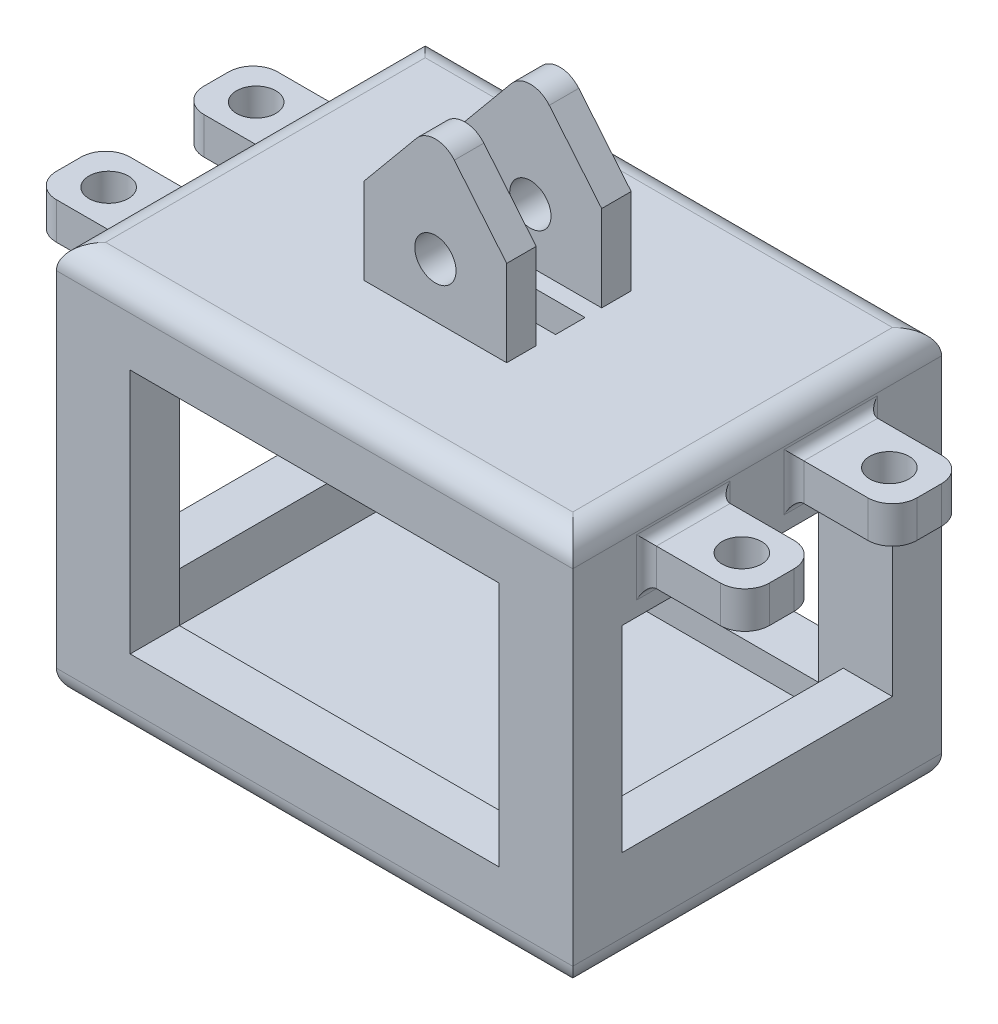
from build123d import *

# Parameters (mm, degrees)
SKETCH1_W               = 105
SKETCH1_H               = 75
BOSS_EXTRUDE1_DEPTH     = 80
SHELL1_T                = -10
SKETCH2_W               = 10
SKETCH2_H               = 60
BOSS_EXTRUDE2_DEPTH     = 60
FILLET1_R               = 5
SKETCH3_W               = 75
SKETCH3_H               = 50
CUT_EXTRUDE1_DEPTH      = 152.822264507
SKETCH4_W               = 55
SKETCH4_H               = 40
CUT_EXTRUDE2_DEPTH      = 152.822264507
SKETCH5_W               = 15
SKETCH5_H               = 7.5
BOSS_EXTRUDE3_DEPTH     = 20
SKETCH6_R               = 4
CUT_EXTRUDE3_DEPTH      = 163.807401552
MIRROR2_COPY_1_SKETCH_W = 15
MIRROR2_COPY_1_SKETCH_H = 7.5
MIRROR2_COPY_1_DEPTH    = 20
MIRROR2_COPY_2_SKETCH_R = 4
MIRROR2_COPY_2_DEPTH    = 163.807401552
FILLET3_R               = 2
SKETCH7_W               = 29
SKETCH7_H               = 6
CUT_EXTRUDE4_DEPTH      = 15
SKETCH8_W               = 29
SKETCH8_H               = 6
BOSS_EXTRUDE4_DEPTH     = 35
SKETCH9_R               = 4.2
CUT_EXTRUDE5_DEPTH      = 35


with BuildPart() as part:
    # Sketch1 → Boss-Extrude1 (new body)
    with BuildSketch(Plane(origin=(0, 0, 0), x_dir=(1, 0, 0), z_dir=(0, 1, 0))):
        with Locations((52.5, 37.5)):
            Rectangle(SKETCH1_W, SKETCH1_H)
    extrude(amount=BOSS_EXTRUDE1_DEPTH)

    # Shell1
    shell1_openings = [part.faces().sort_by_distance(p)[0] for p in [
        (0, 40, -37.5),
    ]]
    offset(amount=SHELL1_T, openings=shell1_openings, kind=Kind.INTERSECTION)

    # Sketch2 → Boss-Extrude2 (add)
    with BuildSketch(Plane.XY.offset(-65)):
        with Locations((5, 40)):
            Rectangle(SKETCH2_W, SKETCH2_H)
    extrude(amount=BOSS_EXTRUDE2_DEPTH)

    # Fillet1
    fillet1_edges = [part.edges().sort_by_distance(p)[0] for p in [
        (105, 80, -37.5),
        (52.5, 80, -75),
        (0, 80, -37.5),
        (52.5, 0, -75),
        (105, 0, -37.5),
        (52.5, 0, 0),
        (0, 0, -37.5),
        (52.5, 80, 0),
    ]]
    fillet(fillet1_edges, radius=FILLET1_R)

    # Sketch3 → Cut-Extrude1 (cut, through all)
    with BuildSketch(Plane.XY):
        with Locations((52.5, 40)):
            Rectangle(SKETCH3_W, SKETCH3_H)
    extrude(amount=-CUT_EXTRUDE1_DEPTH, mode=Mode.SUBTRACT)

    # Sketch4 → Cut-Extrude2 (cut, through all)
    with BuildSketch(Plane.ZY):
        with Locations((-37.5, 40)):
            Rectangle(SKETCH4_W, SKETCH4_H)
    extrude(amount=-CUT_EXTRUDE2_DEPTH, mode=Mode.SUBTRACT)

    # Sketch5 → Boss-Extrude3 (add)
    with BuildSketch(Plane(origin=(105, 0, 0), x_dir=(0, 0, -1), z_dir=(1, 0, 0))):
        with Locations((22.5, 68.75)):
            Rectangle(SKETCH5_W, SKETCH5_H)
    boss_extrude3 = extrude(amount=BOSS_EXTRUDE3_DEPTH)

    # Sketch6 → Cut-Extrude3 (cut, through all)
    with BuildSketch(Plane(origin=(0, 72.5, 0), x_dir=(1, 0, 0), z_dir=(0, 1, 0))):
        with BuildLine():
            Line((125, 30), (120, 30))
            ThreePointArc((120, 30), (123.535533906, 28.535533906), (125, 25))
            Line((125, 25), (125, 30))
        make_face()
        with Locations(Location((116.877501001, 22.5, 0), (0, 0, 270))):
            Circle(SKETCH6_R)
        with BuildLine():
            ThreePointArc((125, 20), (123.535533906, 16.464466094), (120, 15))
            Line((120, 15), (125, 15))
            Line((125, 15), (125, 20))
        make_face()
    cut_extrude3 = extrude(amount=-CUT_EXTRUDE3_DEPTH, mode=Mode.SUBTRACT)

    # Mirror1: Boss-Extrude3, Cut-Extrude3 across plane
    add(boss_extrude3.mirror(Plane(origin=(52.5, 0, 0), x_dir=(0, 0, 1), z_dir=(1, 0, 0))))
    add(cut_extrude3.mirror(Plane(origin=(52.5, 0, 0), x_dir=(0, 0, 1), z_dir=(1, 0, 0))), mode=Mode.SUBTRACT)

    # Mirror2: Boss-Extrude3, Cut-Extrude3 across plane
    add(boss_extrude3.mirror(Plane.XY.offset(-37.5)))
    add(cut_extrude3.mirror(Plane.XY.offset(-37.5)), mode=Mode.SUBTRACT)

    # Mirror2 copy 1 sketch → Mirror2 copy 1 (add)
    with BuildSketch(Plane(origin=(0, 0, -75), x_dir=(0, 0, 1), z_dir=(-1, 0, 0))):
        with Locations((22.5, 68.75)):
            Rectangle(MIRROR2_COPY_1_SKETCH_W, MIRROR2_COPY_1_SKETCH_H)
    extrude(amount=MIRROR2_COPY_1_DEPTH)

    # Mirror2 copy 2 sketch → Mirror2 copy 2 (cut, through all)
    with BuildSketch(Plane(origin=(105, 72.5, -75), x_dir=(-1, 0, 0), z_dir=(0, 1, 0))):
        with BuildLine():
            Line((125, 30), (120, 30))
            ThreePointArc((120, 30), (123.535533906, 28.535533906), (125, 25))
            Line((125, 25), (125, 30))
        make_face()
        with Locations(Location((116.877501001, 22.5, 0), (0, 0, 270))):
            Circle(MIRROR2_COPY_2_SKETCH_R)
        with BuildLine():
            ThreePointArc((125, 20), (123.535533906, 16.464466094), (120, 15))
            Line((120, 15), (125, 15))
            Line((125, 15), (125, 20))
        make_face()
    extrude(amount=-MIRROR2_COPY_2_DEPTH, mode=Mode.SUBTRACT)

    # Fillet3
    fillet3_edges = [part.edges().sort_by_distance(p)[0] for p in [
        (105, 68.75, -15),
        (105, 65, -22.5),
        (105, 68.75, -30),
        (105, 72.5, -22.5),
        (0, 68.75, -15),
        (0, 65, -22.5),
        (0, 68.75, -30),
        (0, 72.5, -22.5),
        (0, 68.75, -60),
        (0, 65, -52.5),
        (0, 68.75, -45),
        (0, 72.5, -52.5),
        (105, 68.75, -60),
        (105, 65, -52.5),
        (105, 68.75, -45),
        (105, 72.5, -52.5),
    ]]
    fillet(fillet3_edges, radius=FILLET3_R)

    # Sketch7 → Cut-Extrude4 (cut)
    with BuildSketch(Plane(origin=(0, 80, 0), x_dir=(1, 0, 0), z_dir=(0, 1, 0))):
        with Locations((52.5, 37.5)):
            Rectangle(SKETCH7_W, SKETCH7_H)
    extrude(amount=-CUT_EXTRUDE4_DEPTH, mode=Mode.SUBTRACT)

    # Sketch8 → Boss-Extrude4 (add)
    with BuildSketch(Plane(origin=(0, 80, 0), x_dir=(1, 0, 0), z_dir=(0, 1, 0))):
        with Locations((52.5, 46.877224158)):
            Rectangle(SKETCH8_W, SKETCH8_H)
        with Locations((52.5, 27.56334528)):
            Rectangle(SKETCH8_W, SKETCH8_H)
    extrude(amount=BOSS_EXTRUDE4_DEPTH)

    # Sketch9 → Cut-Extrude5 (cut)
    with BuildSketch(Plane.XY.offset(-24.56334528)):
        with BuildLine():
            Line((38, 115), (38, 97.5))
            Line((38, 97.5), (48.649892195, 110.353318167))
            ThreePointArc((48.649892195, 110.353318167), (52.5, 112.163228843), (56.350107805, 110.353318167))
            Line((56.350107805, 110.353318167), (67, 97.5))
            Line((67, 97.5), (67, 115))
            Line((67, 115), (38, 115))
        make_face()
        with Locations((52.5, 91)):
            Circle(SKETCH9_R)
    extrude(amount=-CUT_EXTRUDE5_DEPTH, mode=Mode.SUBTRACT)


solid = part.part
